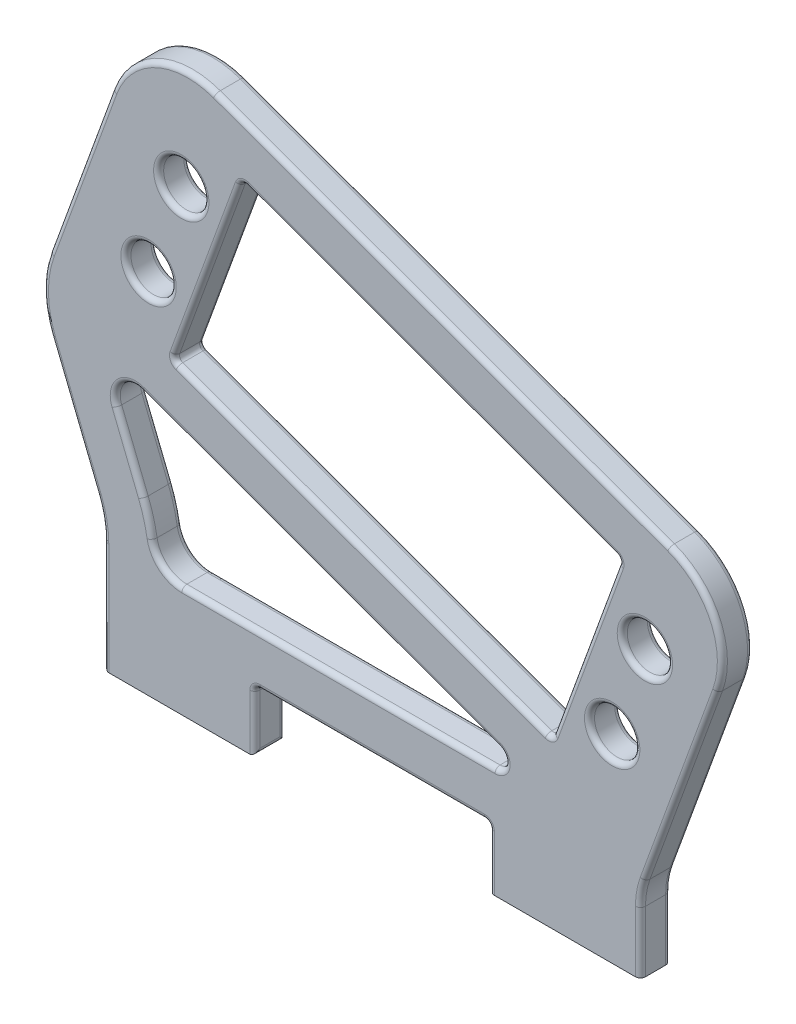
from build123d import *

# Parameters (mm, degrees)
SKETCH1_R           = 2.25
BOSS_EXTRUDE1_DEPTH = 3
FILLET1_R           = 8
FILLET2_R           = 10
FILLET3_R           = 7.5
CUT_EXTRUDE1_DEPTH  = 10
FILLET4_R           = 0.5


with BuildPart() as part:
    # Sketch1 → Boss-Extrude1 (new body)
    with BuildSketch(Plane.XY):
        Polygon((0, 0), (15, 0), (15, 6), (38.3, 6), (38.3, 0), (53.3, 0), (53.3, 7.386691303), (63.695988946, 35.949436184), (3.555661215, 57.838725357), (-6.704943084, 29.647946733), (0, 13), align=None)
        with Locations((7.699052679, 45.422832027)):
            Circle(SKETCH1_R, mode=Mode.SUBTRACT)
        with Locations(Location((4.449861318, 36.495752129, 0), (0, 0, 180))):
            Circle(SKETCH1_R, mode=Mode.SUBTRACT)
        with Locations(Location((53.743991098, 28.663845004, 0), (0, 0, 180))):
            Circle(SKETCH1_R, mode=Mode.SUBTRACT)
        with Locations((50.494799736, 19.736765107)):
            Circle(SKETCH1_R, mode=Mode.SUBTRACT)
        Polygon((6.882872359, 30.023275225), (13.723275225, 48.817127641), (51.310980057, 35.136321908), (44.47057719, 16.342469492), align=None, mode=Mode.SUBTRACT)
    extrude(amount=BOSS_EXTRUDE1_DEPTH)

    # Fillet1
    fillet1_edges = [part.edges().sort_by_distance(p)[0] for p in [
        (3.555661215, 57.838725357, 1.5),
        (63.695988946, 35.949436184, 1.5),
    ]]
    fillet(fillet1_edges, radius=FILLET1_R)

    # Fillet2
    fillet2_edges = [part.edges().sort_by_distance(p)[0] for p in [
        (0, 13, 1.5),
        (-6.704943084, 29.647946733, 1.5),
    ]]
    fillet(fillet2_edges, radius=FILLET2_R)

    # Fillet3
    fillet3_edges = [part.edges().sort_by_distance(p)[0] for p in [
        (53.3, 7.386691303, 1.5),
    ]]
    fillet(fillet3_edges, radius=FILLET3_R)

    # Sketch2 → Cut-Extrude1 (cut)
    with BuildSketch(Plane.XY.offset(3)):
        with BuildLine():
            Line((3.913922127, 16.665713982), (1.28692545, 23.188379454))
            ThreePointArc((1.28692545, 23.188379454), (1.70419878, 25.325661868), (3.826155353, 25.814940368))
            Line((3.826155353, 25.814940368), (39.200607808, 12.939692621))
            ThreePointArc((39.200607808, 12.939692621), (39.843395417, 11.826351822), (38.858587664, 11))
            Line((38.858587664, 11), (7.758590807, 11))
            ThreePointArc((7.758590807, 11), (5.81810785, 11.712091372), (4.798825673, 13.510316073))
            ThreePointArc((4.798825673, 13.510316073), (4.442804629, 15.112253764), (3.913922127, 16.665713982))
        make_face()
    extrude(amount=-CUT_EXTRUDE1_DEPTH, mode=Mode.SUBTRACT)

    # Fillet4
    fillet4_edges = [part.edges().sort_by_distance(p)[0] for p in [
        (15, 3, 3),
        (2.600423788, 19.927046718, 0),
        (4.442804629, 15.112253764, 0),
        (5.81810785, 11.712091372, 0),
        (23.308589236, 11, 0),
        (39.843395417, 11.826351822, 0),
        (21.51338158, 19.377316494, 0),
        (1.70419878, 25.325661868, 0),
        (1.70419878, 25.325661868, 3),
        (2.600423788, 19.927046718, 3),
        (4.442804629, 15.112253764, 3),
        (5.81810785, 11.712091372, 3),
        (23.308589236, 11, 3),
        (39.843395417, 11.826351822, 3),
        (21.51338158, 19.377316494, 3),
        (53.3, 3.032119474, 0),
        (38.3, 3, 0),
        (26.65, 6, 0),
        (26.65, 6, 3),
        (15, 3, 0),
        (38.3, 3, 3),
        (38.3, 6, 1.5),
        (15, 6, 1.5),
        (15, 0, 1.5),
        (0, 0, 1.5),
        (53.3, 3.032119474, 3),
        (25.676724775, 23.182872359, 0),
        (6.882872359, 30.023275225, 1.5),
        (47.890778624, 25.7393957, 0),
        (44.47057719, 16.342469492, 1.5),
        (32.517127641, 41.976724775, 0),
        (51.310980057, 35.136321908, 1.5),
        (10.303073792, 39.420201433, 0),
        (13.723275225, 48.817127641, 1.5),
        (25.676724775, 23.182872359, 3),
        (47.890778624, 25.7393957, 3),
        (32.517127641, 41.976724775, 3),
        (10.303073792, 39.420201433, 3),
        (5.449052679, 45.422832027, 0),
        (5.449052679, 45.422832027, 3),
        (6.699861318, 36.495752129, 0),
        (6.699861318, 36.495752129, 3),
        (55.993991098, 28.663845004, 0),
        (55.993991098, 28.663845004, 3),
        (48.244799736, 19.736765107, 0),
        (48.244799736, 19.736765107, 3),
        (33.62582508, 46.89408077, 0),
        (33.62582508, 46.89408077, 3),
        (-2.287352817, 41.785176242, 0),
        (4.956094941, 54.83548554, 0),
        (60.692749129, 34.549002458, 0),
        (-2.287352817, 41.785176242, 3),
        (4.956094941, 54.83548554, 3),
        (60.692749129, 34.549002458, 3),
        (0, 5.53094822, 0),
        (0, 5.53094822, 3),
        (-2.998639747, 20.44543155, 0),
        (-2.998639747, 20.44543155, 3),
        (-5.995850797, 29.659934393, 0),
        (-5.995850797, 29.659934393, 3),
        (-0.182681607, 12.964594413, 0),
        (-0.182681607, 12.964594413, 3),
        (57.356066572, 18.53064262, 0),
        (57.356066572, 18.53064262, 3),
        (53.413941852, 7.36660028, 0),
        (53.413941852, 7.36660028, 3),
    ]]
    fillet(fillet4_edges, radius=FILLET4_R)


solid = part.part
